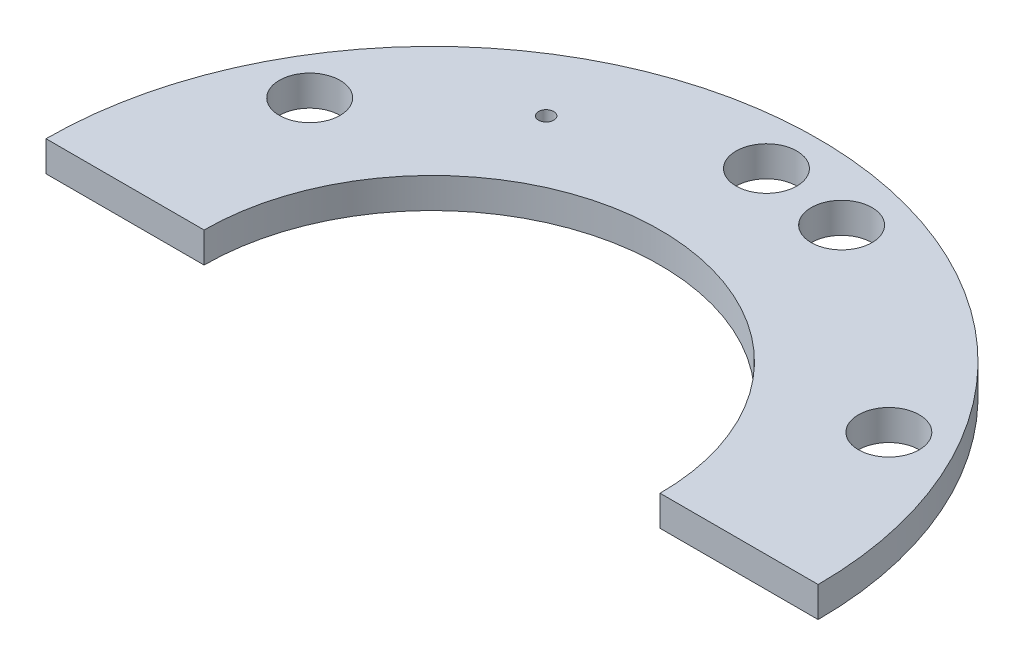
from build123d import *

# Parameters (mm, degrees)
SKETCH1_R               = 12.7
BOSS_EXTRUDE1_DEPTH     = 1
CUT_EXTRUDE1_DEPTH      = 18.98832955
CUT_EXTRUDE1_DEPTH_BACK = 18.98832955
SKETCH19_R              = 1
CUT_EXTRUDE2_DEPTH      = 18.98832955
CUT_EXTRUDE2_DEPTH_BACK = 18.98832955
SKETCH20_R              = 7.5
SKETCH21_W              = 65.874202484
SKETCH21_H              = 51.979273979
CUT_EXTRUDE3_DEPTH      = 18.98832955
CUT_EXTRUDE4_DEPTH      = 18.98832955
CUT_EXTRUDE4_DEPTH_BACK = 18.98832955
SKETCH22_R              = 1
SKETCH22_R_2            = 0.25


with BuildPart() as part:
    # Sketch1 → Boss-Extrude1 (new body)
    with BuildSketch(Plane(origin=(0, 0, 0), x_dir=(1, 0, 0), z_dir=(0, 1, 0))):
        with Locations(Location((0, 0, 0), (0, 0, 270))):
            Circle(SKETCH1_R)
    extrude(amount=BOSS_EXTRUDE1_DEPTH)

    # Sketch19 → Cut-Extrude1 (cut, two sides: drawn at the far end of the back side and taken through both)
    with BuildSketch(Plane(origin=(0, 1, 0), x_dir=(1, 0, 0), z_dir=(0, 1, 0)).offset(-CUT_EXTRUDE1_DEPTH_BACK)):
        with Locations(Location((0, 11, 0), (0, 0, 270))):
            Circle(SKETCH19_R)
        with Locations(Location((9.526279442, 5.5, 0), (0, 0, 270))):
            Circle(SKETCH19_R)
        with Locations(Location((9.526279442, -5.5, 0), (0, 0, 270))):
            Circle(SKETCH19_R)
        with Locations(Location((0, -11, 0), (0, 0, 270))):
            Circle(SKETCH19_R)
        with Locations(Location((-9.526279442, -5.5, 0), (0, 0, 270))):
            Circle(SKETCH19_R)
        with Locations(Location((-9.526279442, 5.5, 0), (0, 0, 270))):
            Circle(SKETCH19_R)
    extrude(amount=CUT_EXTRUDE1_DEPTH + CUT_EXTRUDE1_DEPTH_BACK, mode=Mode.SUBTRACT)

    # Sketch20 → Cut-Extrude2 (cut, two sides: drawn at the far end of the back side and taken through both)
    with BuildSketch(Plane(origin=(0, 1, 0), x_dir=(1, 0, 0), z_dir=(0, 1, 0)).offset(-CUT_EXTRUDE2_DEPTH_BACK)):
        with Locations(Location((0, 0, 0), (0, 0, 270))):
            Circle(SKETCH20_R)
    extrude(amount=CUT_EXTRUDE2_DEPTH + CUT_EXTRUDE2_DEPTH_BACK, mode=Mode.SUBTRACT)

    # Sketch21 → Cut-Extrude3 (cut, through all)
    with BuildSketch(Plane.XY):
        with Locations((-3.816154381, 6.321647006)):
            Rectangle(SKETCH21_W, SKETCH21_H)
    extrude(amount=CUT_EXTRUDE3_DEPTH, mode=Mode.SUBTRACT)

    # Sketch22 → Cut-Extrude4 (cut, two sides: drawn at the far end of the back side and taken through both)
    with BuildSketch(Plane(origin=(0, 1, 0), x_dir=(1, 0, 0), z_dir=(0, 1, 0)).offset(-CUT_EXTRUDE4_DEPTH_BACK)):
        with Locations(Location((2.847009496, 10.625184089, 0), (0, 0, 270))):
            Circle(SKETCH22_R)
        with Locations(Location((-5.125, 8.876760389, 0), (0, 0, 270))):
            Circle(SKETCH22_R_2)
    extrude(amount=CUT_EXTRUDE4_DEPTH + CUT_EXTRUDE4_DEPTH_BACK, mode=Mode.SUBTRACT)


solid = part.part
